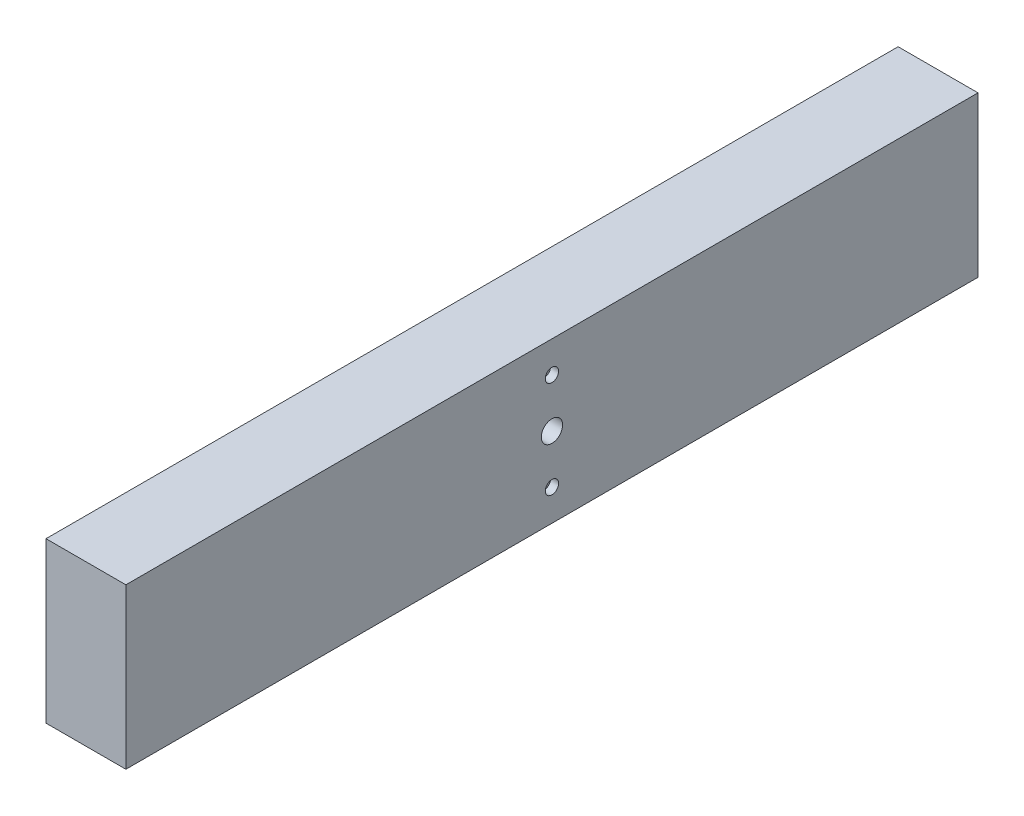
from build123d import *

# Parameters (mm, degrees)
SKETCH1_W           = 30
SKETCH1_H           = 60
BOSS_EXTRUDE1_DEPTH = 160
SKETCH2_R           = 2.5
CUT_EXTRUDE1_DEPTH  = 3
SKETCH3_R           = 4
CUT_EXTRUDE2_DEPTH  = 10


with BuildPart() as part:
    # Sketch1 → Boss-Extrude1 (new, symmetric)
    with BuildSketch(Plane.XY):
        Rectangle(SKETCH1_W, SKETCH1_H)
    extrude(amount=BOSS_EXTRUDE1_DEPTH, both=True)

    # Sketch2 → Cut-Extrude1 (cut)
    with BuildSketch(Plane(origin=(15, 0, 0), x_dir=(0, 0, -1), z_dir=(1, 0, 0))):
        with Locations((0, 18.25)):
            Circle(SKETCH2_R)
        with Locations(Location((0, -18.25, 0), (0, 0, 180))):
            Circle(SKETCH2_R)
    extrude(amount=-CUT_EXTRUDE1_DEPTH, mode=Mode.SUBTRACT)

    # Sketch3 → Cut-Extrude2 (cut)
    with BuildSketch(Plane(origin=(15, 0, 0), x_dir=(0, 0, -1), z_dir=(1, 0, 0))):
        Circle(SKETCH3_R)
    extrude(amount=-CUT_EXTRUDE2_DEPTH, mode=Mode.SUBTRACT)


solid = part.part
